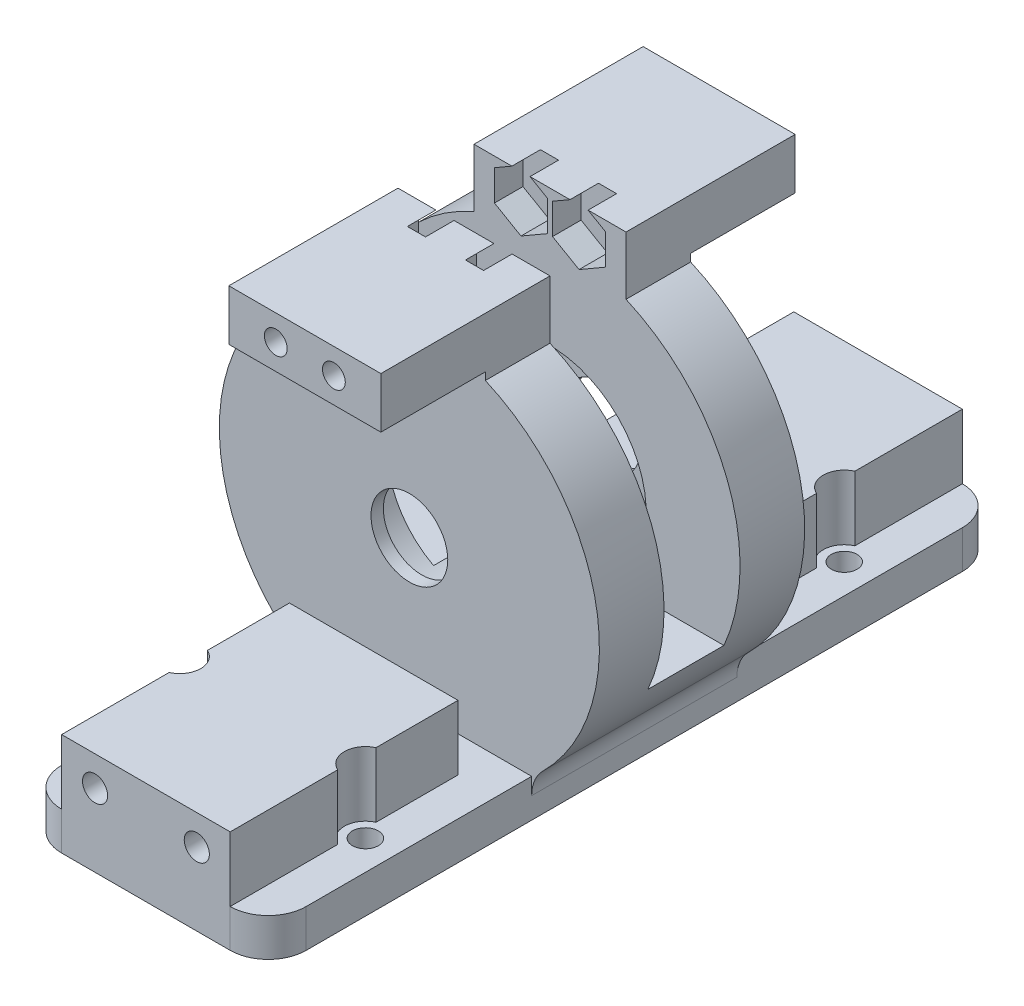
from build123d import *

# Parameters (mm, degrees)
SKETCH1_R                      = 6.4135
BOSS_EXTRUDE1_DEPTH            = 34.29
CUT_EXTRUDE1_REACH             = 100.106
SKETCH3_W                      = 12.7
SKETCH3_H                      = 51.6425
CUT_EXTRUDE1_DIRECTION_2_REACH = 100.106
SKETCH5_R                      = 2.159
CUT_EXTRUDE2_DEPTH             = 86.858993575
SKETCH6_W                      = 25.4
SKETCH6_H                      = 8.47980016
BOSS_EXTRUDE2_DEPTH            = 17.4625
CUT_EXTRUDE9_START             = -6.35
SKETCH12_R                     = 14.478
CUT_EXTRUDE9_DEPTH             = 15.08125
SKETCH8_R                      = 1.905
CUT_EXTRUDE11_DEPTH            = 40.9575
CUT_EXTRUDE12_START            = -4.7625
SKETCH14_R                     = 1.905
CUT_EXTRUDE12_DEPTH            = 4.7625
FILLET4_R                      = 6.35
CHAMFER1_SIZE                  = 1.5875
CUT_EXTRUDE13_DEPTH            = 95.203417847
SKETCH16_W                     = 40.857524936
SKETCH16_H                     = 6.35
BOSS_EXTRUDE3_DEPTH            = 61.16
SKETCH17_R                     = 2.159
CUT_EXTRUDE14_DEPTH            = 6.35
FILLET5_R                      = 6.35
SKETCH18_W                     = 28.157524936
SKETCH18_H                     = 38.06
BOSS_EXTRUDE4_DEPTH            = 10.8
SKETCH19_R                     = 2.1
CUT_EXTRUDE15_DEPTH            = 40
SKETCH21_R                     = 3.5
CUT_EXTRUDE16_DEPTH            = 11
SKETCH22_R                     = 3.5
CUT_EXTRUDE17_DEPTH            = 11


with BuildPart() as part:
    # Sketch1 → Boss-Extrude1 (new body)
    # profile 1 of 3: a face of its own
    with BuildSketch(Plane.XY):
        with BuildLine():
            Line((12.7, 6.75), (20.428762468, 6.75))
            ThreePointArc((20.428762468, 6.75), (31.422640825, 35.602442589), (12.7, 60.154255663))
            Line((12.7, 60.154255663), (12.7, 6.75))
        make_face()
    # profile 2 of 3: a face of its own
    with BuildSketch(Plane.XY):
        Polygon((-47, 0.4), (-10.625, 0.4), (10.625, 0.4), (47, 0.4), (47, 6.75), (12.7, 6.75), (12.7, 69.8924), (-12.7, 69.8924), (-12.7, 6.75), (-47, 6.75), align=None)
        with Locations((0, 31.0549)):
            Circle(SKETCH1_R, mode=Mode.SUBTRACT)
    # profile 3 of 3: a face of its own
    with BuildSketch(Plane.XY):
        with BuildLine():
            ThreePointArc((-12.7, 60.154255663), (-31.422640825, 35.602442589), (-20.428762468, 6.75))
            Line((-20.428762468, 6.75), (-12.7, 6.75))
            Line((-12.7, 6.75), (-12.7, 60.154255663))
        make_face()
    extrude(amount=BOSS_EXTRUDE1_DEPTH)

    # Sketch3 → Cut-Extrude1 (cut, up to next)
    with BuildSketch(Plane(origin=(12.7, 0, 0), x_dir=(0, 0, -1), z_dir=(1, 0, 0)), mode=Mode.PRIVATE) as cut_extrude1_sk1:
        with Locations((-17.145, 44.07115)):
            Rectangle(SKETCH3_W, SKETCH3_H)
    cut_extrude1_tool1 = extrude(cut_extrude1_sk1.sketch, amount=-CUT_EXTRUDE1_REACH, mode=Mode.PRIVATE) & part.part
    add(cut_extrude1_tool1.solids().sort_by_distance((12.7, 44.07115, 17.145))[0], mode=Mode.SUBTRACT)

    # Sketch3 → Cut-Extrude1 direction 2 (cut, up to next)
    with BuildSketch(Plane(origin=(12.7, 0, 0), x_dir=(0, 0, -1), z_dir=(1, 0, 0)), mode=Mode.PRIVATE) as cut_extrude1_direction_2_sk1:
        with Locations((-17.145, 44.07115)):
            Rectangle(SKETCH3_W, SKETCH3_H)
    cut_extrude1_direction_2_tool1 = extrude(cut_extrude1_direction_2_sk1.sketch, amount=CUT_EXTRUDE1_DIRECTION_2_REACH, mode=Mode.PRIVATE) & part.part
    add(cut_extrude1_direction_2_tool1.solids().sort_by_distance((12.7, 44.07115, 17.145))[0], mode=Mode.SUBTRACT)

    # Sketch5 → Cut-Extrude2 (cut, through all)
    with BuildSketch(Plane(origin=(0, 6.75, 0), x_dir=(1, 0, 0), z_dir=(0, 1, 0))):
        with Locations(Location((40, -27.94, 0), (0, 0, 180))):
            Circle(SKETCH5_R)
        with Locations(Location((40, -6.35, 0), (0, 0, 180))):
            Circle(SKETCH5_R)
        with Locations(Location((-40, -6.35, 0), (0, 0, 180))):
            Circle(SKETCH5_R)
        with Locations(Location((-40, -27.94, 0), (0, 0, 180))):
            Circle(SKETCH5_R)
    extrude(amount=-CUT_EXTRUDE2_DEPTH, mode=Mode.SUBTRACT)

    # Sketch6 → Boss-Extrude2 (add)
    with BuildSketch(Plane.XY.offset(34.29)):
        with Locations((0, 65.65249992)):
            Rectangle(SKETCH6_W, SKETCH6_H)
    boss_extrude2 = extrude(amount=BOSS_EXTRUDE2_DEPTH)

    # Sketch12 → Cut-Extrude9 (cut)
    with BuildSketch(Plane.XY.offset(23.495).offset(CUT_EXTRUDE9_START)):
        with Locations((0, 31.0549)):
            Circle(SKETCH12_R)
    cut_extrude9 = extrude(amount=CUT_EXTRUDE9_DEPTH, mode=Mode.SUBTRACT)

    # Sketch8 → Cut-Extrude11 (cut)
    with BuildSketch(Plane.XY.offset(51.7525)):
        with Locations((-4.8514, 65.65249992)):
            Circle(SKETCH8_R)
        with Locations((4.8514, 65.65249992)):
            Circle(SKETCH8_R)
    cut_extrude11 = extrude(amount=-CUT_EXTRUDE11_DEPTH, mode=Mode.SUBTRACT)

    # Sketch14 → Cut-Extrude12 (cut)
    # profile 1 of 2: a face of its own
    with BuildSketch(Plane(origin=(0, 0, 23.495), x_dir=(-1, 0, 0), z_dir=(0, 0, -1)).offset(CUT_EXTRUDE12_START)):
        Polygon((-4.8514, 60.538186898), (-0.422275, 63.095343409), (-0.422275, 68.209656431), (-3.336872358, 69.8924), (-6.365927642, 69.8924), (-9.280525, 68.209656431), (-9.280525, 63.095343409), align=None)
        with Locations(Location((-4.8514, 65.65249992, 0), (0, 0, 180))):
            Circle(SKETCH14_R, mode=Mode.SUBTRACT)
    # profile 2 of 2: a face of its own
    with BuildSketch(Plane(origin=(0, 0, 23.495), x_dir=(-1, 0, 0), z_dir=(0, 0, -1)).offset(CUT_EXTRUDE12_START)):
        Polygon((6.365927642, 69.8924), (3.336872358, 69.8924), (0.422275, 68.209656431), (0.422275, 63.095343409), (4.8514, 60.538186898), (9.280525, 63.095343409), (9.280525, 68.209656431), align=None)
        with Locations(Location((4.8514, 65.65249992, 0), (0, 0, 180))):
            Circle(SKETCH14_R, mode=Mode.SUBTRACT)
    cut_extrude12 = extrude(amount=CUT_EXTRUDE12_DEPTH, mode=Mode.SUBTRACT)

    # Mirror4: Boss-Extrude2, Cut-Extrude9, Cut-Extrude11, Cut-Extrude12 across plane
    add(boss_extrude2.mirror(Plane(origin=(0, 0, 17.145), x_dir=(1, 0, 0), z_dir=(0, 0, -1))))
    add(cut_extrude9.mirror(Plane(origin=(0, 0, 17.145), x_dir=(1, 0, 0), z_dir=(0, 0, -1))), mode=Mode.SUBTRACT)
    add(cut_extrude11.mirror(Plane(origin=(0, 0, 17.145), x_dir=(1, 0, 0), z_dir=(0, 0, -1))), mode=Mode.SUBTRACT)
    add(cut_extrude12.mirror(Plane(origin=(0, 0, 17.145), x_dir=(1, 0, 0), z_dir=(0, 0, -1))), mode=Mode.SUBTRACT)

    # Fillet4
    fillet4_edges = [part.edges().sort_by_distance(p)[0] for p in [
        (47, 3.575, 0),
        (-47, 3.575, 0),
        (-47, 3.575, 34.29),
        (47, 3.575, 34.29),
    ]]
    fillet(fillet4_edges, radius=FILLET4_R)

    # Chamfer1
    chamfer1_edges = [part.edges().sort_by_distance(p)[0] for p in [
        (-7.476567629, 43.453021652, 10.795),
    ]]
    chamfer(chamfer1_edges, length=CHAMFER1_SIZE)

    # Sketch15 → Cut-Extrude13 (cut, through all)
    with BuildSketch(Plane(origin=(0, 6.75, 0), x_dir=(1, 0, 0), z_dir=(0, 1, 0))):
        with BuildLine():
            Line((20.428762468, 1.013392391), (20.428762468, -35.303392391))
            ThreePointArc((20.428762468, -35.303392391), (22.863261605, -34.54592678), (25.4, -34.29))
            Line((25.4, -34.29), (40.65, -34.29))
            ThreePointArc((40.65, -34.29), (45.140128061, -32.430128061), (47, -27.94))
            Line((47, -27.94), (47, -6.35))
            ThreePointArc((47, -6.35), (45.140128061, -1.859871939), (40.65, 0))
            Line((40.65, 0), (25.4, 0))
            ThreePointArc((25.4, 0), (22.863261605, 0.25592678), (20.428762468, 1.013392391))
        make_face()
        with BuildLine():
            Line((-40.65, 0), (-25.4, 0))
            ThreePointArc((-25.4, 0), (-22.863261605, 0.25592678), (-20.428762468, 1.013392391))
            Line((-20.428762468, 1.013392391), (-20.428762468, -35.303392391))
            ThreePointArc((-20.428762468, -35.303392391), (-22.863261605, -34.54592678), (-25.4, -34.29))
            Line((-25.4, -34.29), (-40.65, -34.29))
            ThreePointArc((-40.65, -34.29), (-45.140128061, -32.430128061), (-47, -27.94))
            Line((-47, -27.94), (-47, -6.35))
            ThreePointArc((-47, -6.35), (-45.140128061, -1.859871939), (-40.65, 0))
        make_face()
    extrude(amount=-CUT_EXTRUDE13_DEPTH, mode=Mode.SUBTRACT)

    # Sketch16 → Boss-Extrude3 (add, symmetric)
    with BuildSketch(Plane(origin=(0, 0, 17.145), x_dir=(-1, 0, 0), z_dir=(0, 0, -1))):
        with Locations((0, 3.575)):
            Rectangle(SKETCH16_W, SKETCH16_H)
    extrude(amount=BOSS_EXTRUDE3_DEPTH, both=True)

    # Sketch17 → Cut-Extrude14 (cut)
    with BuildSketch(Plane.XZ.offset(-0.4)):
        with Locations((15.5, 57.145)):
            Circle(SKETCH17_R)
        with Locations((-15.5, 57.145)):
            Circle(SKETCH17_R)
        with Locations((15.5, -22.855)):
            Circle(SKETCH17_R)
        with Locations((-15.5, -22.855)):
            Circle(SKETCH17_R)
    extrude(amount=-CUT_EXTRUDE14_DEPTH, mode=Mode.SUBTRACT)

    # Fillet5
    fillet5_edges = [part.edges().sort_by_distance(p)[0] for p in [
        (-20.428762468, 6.75, 17.145),
        (20.428762468, 6.75, 17.145),
        (-20.428762468, 3.575, -44.015),
        (20.428762468, 3.575, -44.015),
        (-20.428762468, 3.575, 78.305),
        (20.428762468, 3.575, 78.305),
    ]]
    fillet(fillet5_edges, radius=FILLET5_R)

    # Sketch18 → Boss-Extrude4 (add)
    with BuildSketch(Plane(origin=(0, 6.75, 0), x_dir=(1, 0, 0), z_dir=(0, 1, 0))):
        with Locations((0, -59.275)):
            Rectangle(SKETCH18_W, SKETCH18_H)
    boss_extrude4 = extrude(amount=BOSS_EXTRUDE4_DEPTH)

    # Mirror5: Boss-Extrude4 across plane
    add(boss_extrude4.mirror(Plane(origin=(0, 0, 17.145), x_dir=(1, 0, 0), z_dir=(0, 0, -1))))

    # Sketch19 → Cut-Extrude15 (cut)
    with BuildSketch(Plane(origin=(0, 0, -44.015), x_dir=(-1, 0, 0), z_dir=(0, 0, -1))):
        with Locations((8.5, 12.5549)):
            Circle(SKETCH19_R)
        with Locations((-8.5, 12.5549)):
            Circle(SKETCH19_R)
    cut_extrude15 = extrude(amount=-CUT_EXTRUDE15_DEPTH, mode=Mode.SUBTRACT)

    # Mirror6: Cut-Extrude15 across plane
    add(cut_extrude15.mirror(Plane(origin=(0, 0, 17.145), x_dir=(1, 0, 0), z_dir=(0, 0, -1))), mode=Mode.SUBTRACT)

    # Sketch21 → Cut-Extrude16 (cut)
    with BuildSketch(Plane(origin=(0, 6.75, 0), x_dir=(1, 0, 0), z_dir=(0, 1, 0))):
        with Locations((15.5, -57.145)):
            Circle(SKETCH21_R)
    cut_extrude16 = extrude(amount=CUT_EXTRUDE16_DEPTH, mode=Mode.SUBTRACT)

    # Sketch22 → Cut-Extrude17 (cut)
    with BuildSketch(Plane(origin=(0, 6.75, 0), x_dir=(1, 0, 0), z_dir=(0, 1, 0))):
        with Locations((-15.5, -57.145)):
            Circle(SKETCH22_R)
    cut_extrude17 = extrude(amount=CUT_EXTRUDE17_DEPTH, mode=Mode.SUBTRACT)

    # Mirror7: Cut-Extrude16, Cut-Extrude17 across plane
    add(cut_extrude16.mirror(Plane(origin=(0, 0, 17.145), x_dir=(1, 0, 0), z_dir=(0, 0, -1))), mode=Mode.SUBTRACT)
    add(cut_extrude17.mirror(Plane(origin=(0, 0, 17.145), x_dir=(1, 0, 0), z_dir=(0, 0, -1))), mode=Mode.SUBTRACT)


solid = part.part
